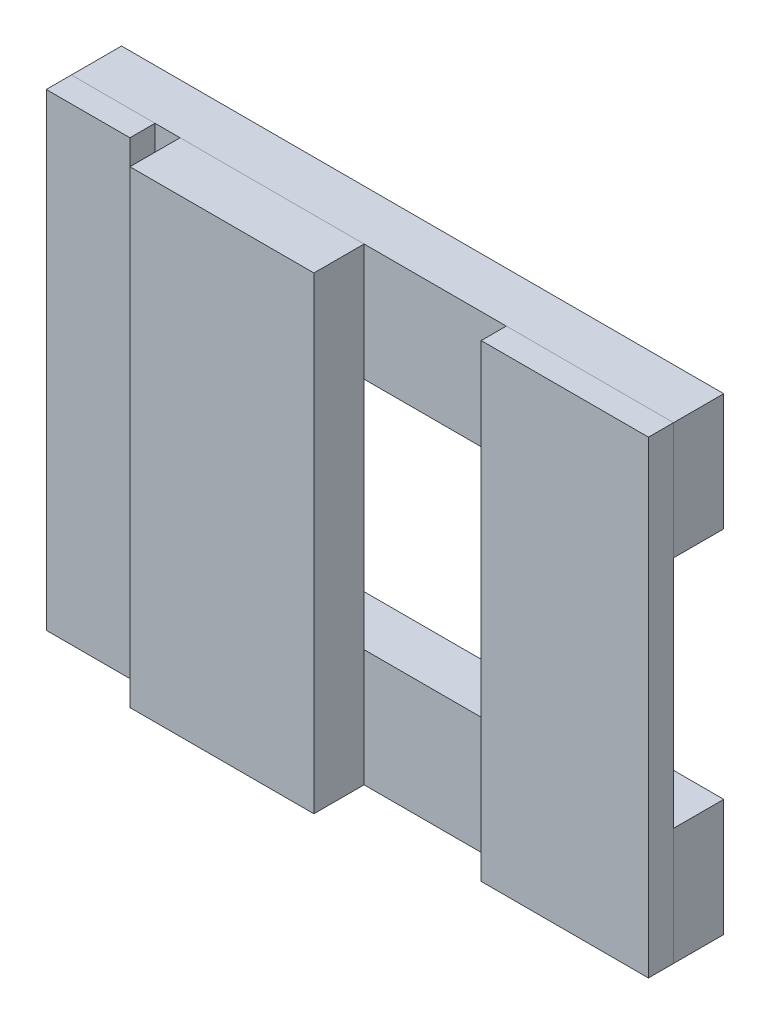
from build123d import *

# Parameters (mm, degrees)
SKETCH2_W             = 457.2
SKETCH2_H             = 88.9
BOSS_EXTRUDE1_DEPTH   = 38.1
BOSS_EXTRUDE1_2_DEPTH = 38.1
SKETCH3_W             = 63.5
SKETCH3_H             = 355.6
BOSS_EXTRUDE2_DEPTH   = 19.05
SKETCH3_W_2           = 127
BOSS_EXTRUDE2_2_DEPTH = 19.05
SKETCH3_3_W           = 139.7
SKETCH3_3_H           = 355.6
BOSS_EXTRUDE3_DEPTH   = 38.1


with BuildPart() as part:
    # Sketch2 → Boss-Extrude1 (new body)
    with BuildSketch(Plane.XY):
        with Locations((10.938284773, 133.35)):
            Rectangle(SKETCH2_W, SKETCH2_H)
    extrude(amount=BOSS_EXTRUDE1_DEPTH)


with BuildPart() as body_2:
    # Sketch2 → Boss-Extrude1 2 (new body)
    with BuildSketch(Plane.XY):
        with Locations((10.938284773, -133.35)):
            Rectangle(SKETCH2_W, SKETCH2_H)
    extrude(amount=BOSS_EXTRUDE1_2_DEPTH)


with BuildPart() as body_3:
    # Sketch3 → Boss-Extrude2 (new body)
    with BuildSketch(Plane.XY.offset(38.1)):
        with Locations((-185.911715227, 0)):
            Rectangle(SKETCH3_W, SKETCH3_H)
    extrude(amount=BOSS_EXTRUDE2_DEPTH)


with BuildPart() as body_4:
    # Sketch3 → Boss-Extrude2 2 (new body)
    with BuildSketch(Plane.XY.offset(38.1)):
        with Locations((176.038284773, 0)):
            Rectangle(SKETCH3_W_2, SKETCH3_H)
    extrude(amount=BOSS_EXTRUDE2_2_DEPTH)


with BuildPart() as body_5:
    # Sketch3<3> → Boss-Extrude3 (new body)
    with BuildSketch(Plane.XY.offset(38.1)):
        with Locations((-65.261715227, 0)):
            Rectangle(SKETCH3_3_W, SKETCH3_3_H)
    extrude(amount=BOSS_EXTRUDE3_DEPTH)


solid = Compound([part.part, body_2.part, body_3.part, body_4.part, body_5.part])
